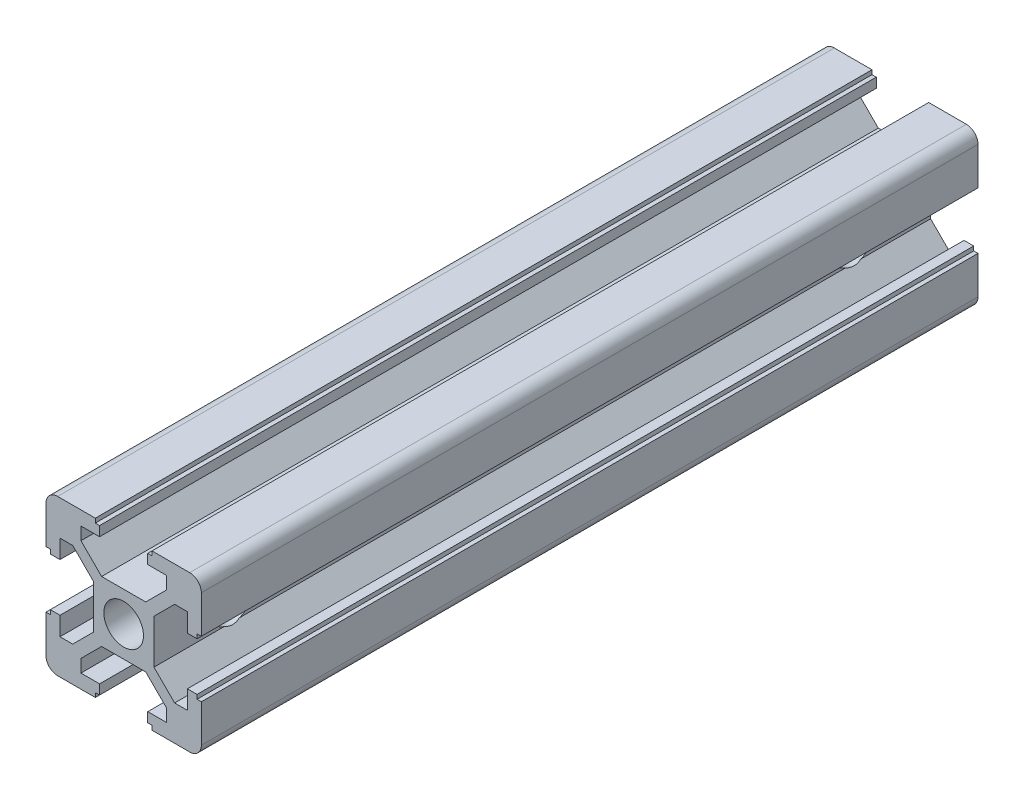
from build123d import *

# Parameters (mm, degrees)
SKETCH_2_R          = 2.55
EXTRUDE_1_DEPTH     = 100
SKETCH_3_R          = 3
CUT_EXTRUDE_1_DEPTH = 103.46950766


with BuildPart() as part:
    # 草图2 → 凸台-拉伸1 (new body)
    with BuildSketch(Plane.XY):
        with BuildLine():
            Line((-3.9, 2.839339828), (-6.560660172, 5.5))
            Line((-6.560660172, 5.5), (-8.2, 5.5))
            Line((-8.2, 5.5), (-8.2, 3.1))
            Line((-8.2, 3.1), (-9.45, 3.1))
            Line((-9.45, 3.1), (-9.45, 3.65))
            Line((-9.45, 3.65), (-10, 3.65))
            Line((-10, 3.65), (-10, 8.5))
            ThreePointArc((-10, 8.5), (-9.560660172, 9.560660172), (-8.5, 10))
            Line((-8.5, 10), (-3.65, 10))
            Line((-3.65, 10), (-3.65, 9.45))
            Line((-3.65, 9.45), (-3.1, 9.45))
            Line((-3.1, 9.45), (-3.1, 8.2))
            Line((-3.1, 8.2), (-5.5, 8.2))
            Line((-5.5, 8.2), (-5.5, 6.560660172))
            Line((-5.5, 6.560660172), (-2.839339828, 3.9))
            Line((-2.839339828, 3.9), (2.839339828, 3.9))
            Line((2.839339828, 3.9), (5.5, 6.560660172))
            Line((5.5, 6.560660172), (5.5, 8.2))
            Line((5.5, 8.2), (3.1, 8.2))
            Line((3.1, 8.2), (3.1, 9.45))
            Line((3.1, 9.45), (3.65, 9.45))
            Line((3.65, 9.45), (3.65, 10))
            Line((3.65, 10), (8.5, 10))
            ThreePointArc((8.5, 10), (9.560660172, 9.560660172), (10, 8.5))
            Line((10, 8.5), (10, 3.65))
            Line((10, 3.65), (9.45, 3.65))
            Line((9.45, 3.65), (9.45, 3.1))
            Line((9.45, 3.1), (8.2, 3.1))
            Line((8.2, 3.1), (8.2, 5.5))
            Line((8.2, 5.5), (6.560660172, 5.5))
            Line((6.560660172, 5.5), (3.9, 2.839339828))
            Line((3.9, 2.839339828), (3.9, -2.839339828))
            Line((3.9, -2.839339828), (6.560660172, -5.5))
            Line((6.560660172, -5.5), (8.2, -5.5))
            Line((8.2, -5.5), (8.2, -3.1))
            Line((8.2, -3.1), (9.45, -3.1))
            Line((9.45, -3.1), (9.45, -3.65))
            Line((9.45, -3.65), (10, -3.65))
            Line((10, -3.65), (10, -8.5))
            ThreePointArc((10, -8.5), (9.560660172, -9.560660172), (8.5, -10))
            Line((8.5, -10), (3.65, -10))
            Line((3.65, -10), (3.65, -9.45))
            Line((3.65, -9.45), (3.1, -9.45))
            Line((3.1, -9.45), (3.1, -8.2))
            Line((3.1, -8.2), (5.5, -8.2))
            Line((5.5, -8.2), (5.5, -6.560660172))
            Line((5.5, -6.560660172), (2.839339828, -3.9))
            Line((2.839339828, -3.9), (-2.839339828, -3.9))
            Line((-2.839339828, -3.9), (-5.5, -6.560660172))
            Line((-5.5, -6.560660172), (-5.5, -8.2))
            Line((-5.5, -8.2), (-3.1, -8.2))
            Line((-3.1, -8.2), (-3.1, -9.45))
            Line((-3.1, -9.45), (-3.65, -9.45))
            Line((-3.65, -9.45), (-3.65, -10))
            Line((-3.65, -10), (-8.5, -10))
            ThreePointArc((-8.5, -10), (-9.560660172, -9.560660172), (-10, -8.5))
            Line((-10, -8.5), (-10, -3.65))
            Line((-10, -3.65), (-9.45, -3.65))
            Line((-9.45, -3.65), (-9.45, -3.1))
            Line((-9.45, -3.1), (-8.2, -3.1))
            Line((-8.2, -3.1), (-8.2, -5.5))
            Line((-8.2, -5.5), (-6.560660172, -5.5))
            Line((-6.560660172, -5.5), (-3.9, -2.839339828))
            Line((-3.9, -2.839339828), (-3.9, 2.839339828))
        make_face()
        Circle(SKETCH_2_R, mode=Mode.SUBTRACT)
    extrude(amount=EXTRUDE_1_DEPTH)

    # 草图3 → 切除-拉伸1 (cut, through all)
    with BuildSketch(Plane(origin=(10, 0, 0), x_dir=(0, 0, -1), z_dir=(1, 0, 0))):
        with Locations(Location((-90, 0, 0), (0, 0, 108.835996158))):
            Circle(SKETCH_3_R)
        with Locations(Location((-10, 0, 0), (0, 0, 108.835996158))):
            Circle(SKETCH_3_R)
    extrude(amount=-CUT_EXTRUDE_1_DEPTH, mode=Mode.SUBTRACT)


solid = part.part
